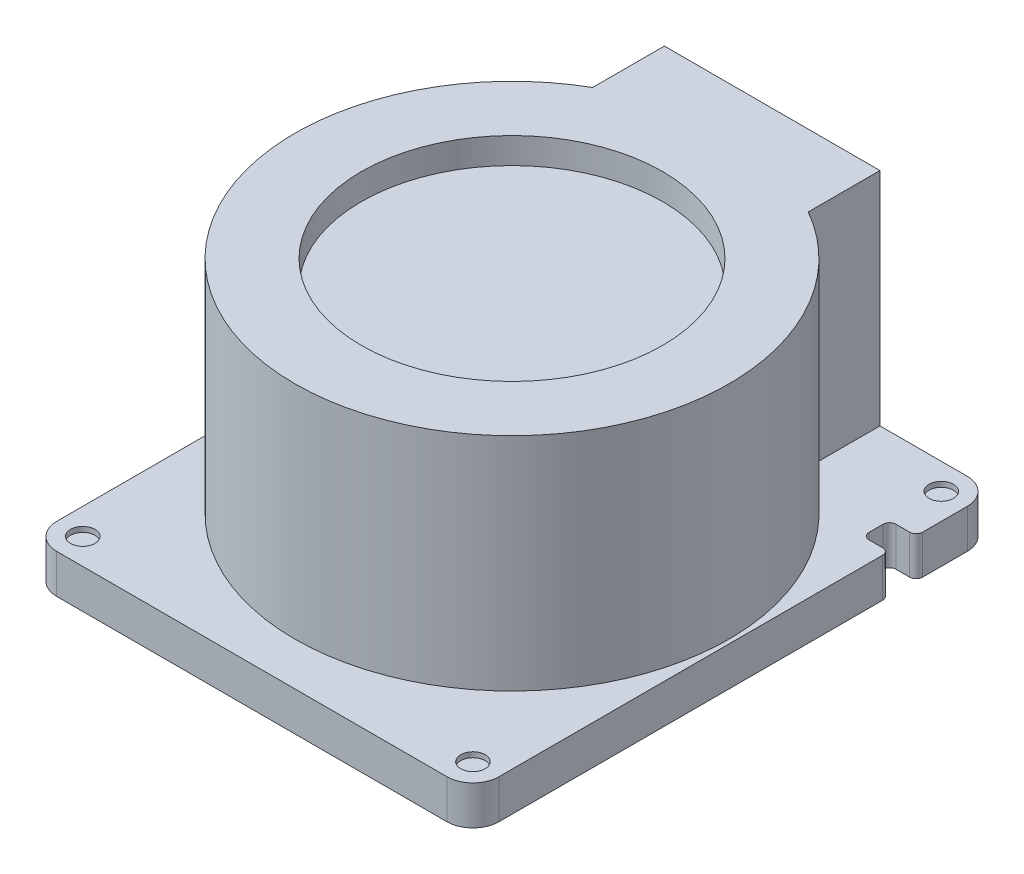
from build123d import *

# Parameters (mm, degrees)
BOSS_EXTRUDE1_DEPTH = 3
SKETCH2_R           = 0.938992972
CUT_EXTRUDE1_DEPTH  = 0.4
BOSS_EXTRUDE2_DEPTH = 17
SKETCH5_R           = 11.578602023
CUT_EXTRUDE2_DEPTH  = 2


with BuildPart() as part:
    # Sketch1 → Boss-Extrude1 (new body)
    with BuildSketch(Plane(origin=(0, 0, 0), x_dir=(1, 0, 0), z_dir=(0, 1, 0))):
        with BuildLine():
            Line((-16.5, 14.065984754), (-15.453193913, 14.065984754))
            ThreePointArc((-15.453193913, 14.065984754), (-15.099640522, 13.919538145), (-14.953193913, 13.565984754))
            Line((-14.953193913, 13.565984754), (-14.953193913, 12.490105557))
            ThreePointArc((-14.953193913, 12.490105557), (-15.099640522, 12.136552166), (-15.453193913, 11.990105557))
            Line((-15.453193913, 11.990105557), (-16.5, 11.990105557))
            ThreePointArc((-16.5, 11.990105557), (-16.853553391, 11.843658947), (-17, 11.490105557))
            Line((-17, 11.490105557), (-17, -18))
            ThreePointArc((-17, -18), (-16.414213562, -19.414213562), (-15, -20))
            Line((-15, -20), (15, -20))
            ThreePointArc((15, -20), (16.414213562, -19.414213562), (17, -18))
            Line((17, -18), (17, 11.490105557))
            ThreePointArc((17, 11.490105557), (16.853553391, 11.843658947), (16.5, 11.990105557))
            Line((16.5, 11.990105557), (15.453193913, 11.990105557))
            ThreePointArc((15.453193913, 11.990105557), (15.099640522, 12.136552166), (14.953193913, 12.490105557))
            Line((14.953193913, 12.490105557), (14.953193913, 13.565984754))
            ThreePointArc((14.953193913, 13.565984754), (15.099640522, 13.919538145), (15.453193913, 14.065984754))
            Line((15.453193913, 14.065984754), (16.5, 14.065984754))
            ThreePointArc((16.5, 14.065984754), (16.853553391, 14.212431364), (17, 14.565984754))
            Line((17, 14.565984754), (17, 18))
            ThreePointArc((17, 18), (16.414213562, 19.414213562), (15, 20))
            Line((15, 20), (-15, 20))
            ThreePointArc((-15, 20), (-16.414213562, 19.414213562), (-17, 18))
            Line((-17, 18), (-17, 14.565984754))
            ThreePointArc((-17, 14.565984754), (-16.853553391, 14.212431364), (-16.5, 14.065984754))
        make_face()
    extrude(amount=BOSS_EXTRUDE1_DEPTH)

    # Sketch2 → Cut-Extrude1 (cut)
    with BuildSketch(Plane(origin=(0, 3, 0), x_dir=(1, 0, 0), z_dir=(0, 1, 0))):
        with Locations(Location((-15, 18, 0), (0, 0, 270))):
            Circle(SKETCH2_R)
        with Locations(Location((-15, -18, 0), (0, 0, 90))):
            Circle(SKETCH2_R)
        with Locations(Location((15, -18, 0), (0, 0, 270))):
            Circle(SKETCH2_R)
        with Locations(Location((15, 18, 0), (0, 0, 90))):
            Circle(SKETCH2_R)
    extrude(amount=-CUT_EXTRUDE1_DEPTH, mode=Mode.SUBTRACT)

    # Sketch4 → Boss-Extrude2 (add)
    with BuildSketch(Plane(origin=(0, 3, 0), x_dir=(1, 0, 0), z_dir=(0, 1, 0))):
        with BuildLine():
            Line((8.287121405, 14.483706302), (8.287121405, 20))
            Line((8.287121405, 20), (-8.287121405, 20))
            Line((-8.287121405, 20), (-8.287121405, 14.483706302))
            ThreePointArc((-8.287121405, 14.483706302), (0, -16.686944879), (8.287121405, 14.483706302))
        make_face()
    extrude(amount=BOSS_EXTRUDE2_DEPTH)

    # Sketch5 → Cut-Extrude2 (cut)
    with BuildSketch(Plane(origin=(0, 20, 0), x_dir=(1, 0, 0), z_dir=(0, 1, 0))):
        with Locations(Location((0, 0, 0), (0, 0, 270))):
            Circle(SKETCH5_R)
    extrude(amount=-CUT_EXTRUDE2_DEPTH, mode=Mode.SUBTRACT)


solid = part.part
